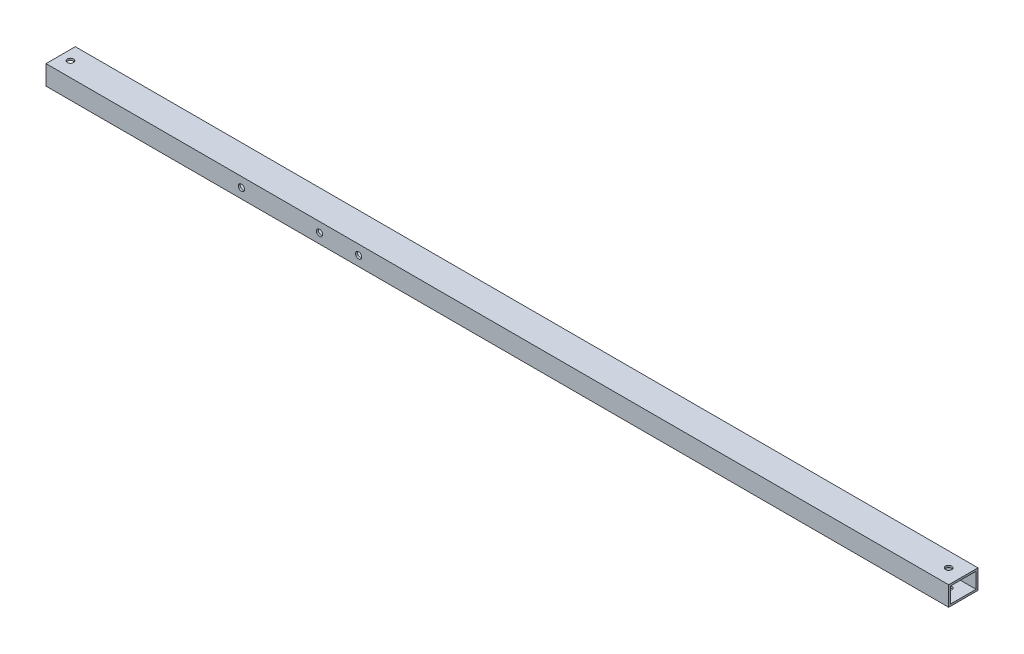
from build123d import *

# Parameters (mm, degrees)
SKETCH_1_W          = 220
SKETCH_1_H          = 10
SKETCH_1_R          = 1.6
EXTRUDE_1_DEPTH     = 15
SKETCH_2_W          = 13
SKETCH_2_H          = 8
CUT_EXTRUDE_1_DEPTH = 2000
SKETCH_3_R          = 1.6
CUT_EXTRUDE_2_DEPTH = 1000
SKETCH_7_W          = 242
SKETCH_7_H          = 15
SKETCH_7_R          = 1.6
EXTRUDE_3_DEPTH     = 10
SKETCH_8_W          = 13
SKETCH_8_H          = 8
CUT_EXTRUDE_4_DEPTH = 1000


with BuildPart() as part:
    # ｽｹｯﾁ1 → ﾎﾞｽ - 押し出し1 (new body)
    with BuildSketch(Plane.XY):
        with Locations((-610, 0)):
            Rectangle(SKETCH_1_W, SKETCH_1_H)
        with Locations((-620, 0)):
            Circle(SKETCH_1_R, mode=Mode.SUBTRACT)
        with Locations((-580, 0)):
            Circle(SKETCH_1_R, mode=Mode.SUBTRACT)
        with Locations((-560, 0)):
            Circle(SKETCH_1_R, mode=Mode.SUBTRACT)
    extrude(amount=EXTRUDE_1_DEPTH)

    # ｽｹｯﾁ2 → ｶｯﾄ - 押し出し1 (cut)
    with BuildSketch(Plane(origin=(-500, 0, 0), x_dir=(0, 0, -1), z_dir=(1, 0, 0))):
        with Locations((-7.5, 0)):
            Rectangle(SKETCH_2_W, SKETCH_2_H)
    extrude(amount=-CUT_EXTRUDE_1_DEPTH, mode=Mode.SUBTRACT)

    # ｽｹｯﾁ3 → ｶｯﾄ - 押し出し2 (cut)
    with BuildSketch(Plane(origin=(0, -5, 0), x_dir=(-1, 0, 0), z_dir=(0, -1, 0))):
        with Locations(Location((715, -7.5, 0), (0, 0, 180))):
            Circle(SKETCH_3_R)
    extrude(amount=-CUT_EXTRUDE_2_DEPTH, mode=Mode.SUBTRACT)

    # ｽｹｯﾁ7 → ﾎﾞｽ - 押し出し3 (add)
    with BuildSketch(Plane.XZ.offset(5)):
        with Locations((-379, 7.5)):
            Rectangle(SKETCH_7_W, SKETCH_7_H)
        with Locations((-265.5, 7.5)):
            Circle(SKETCH_7_R, mode=Mode.SUBTRACT)
    extrude(amount=-EXTRUDE_3_DEPTH)

    # ｽｹｯﾁ8 → ｶｯﾄ - 押し出し4 (cut)
    with BuildSketch(Plane.ZY.offset(720)):
        with Locations((7.5, 0)):
            Rectangle(SKETCH_8_W, SKETCH_8_H)
    extrude(amount=-CUT_EXTRUDE_4_DEPTH, mode=Mode.SUBTRACT)


solid = part.part
